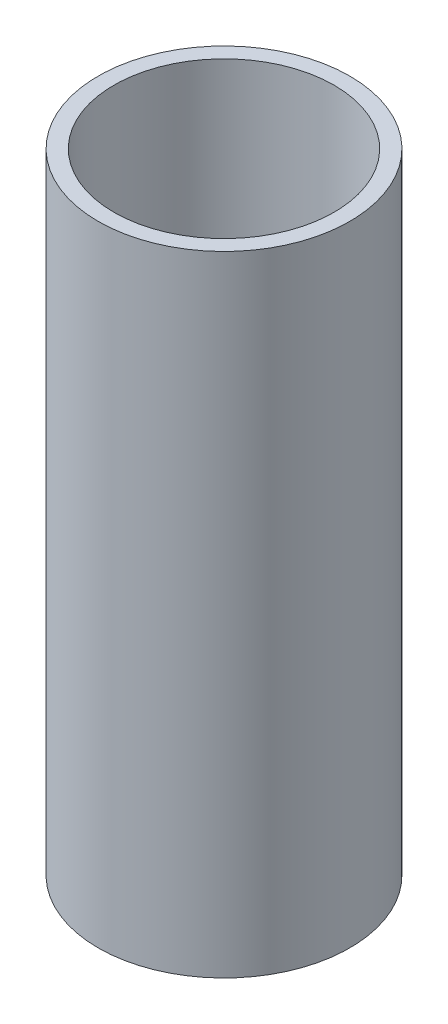
from build123d import *

# Parameters (mm, degrees)
SKETCH1_R           = 16
SKETCH1_R_2         = 14
BOSS_EXTRUDE1_DEPTH = 80


with BuildPart() as part:
    # Sketch1 → Boss-Extrude1 (new body)
    with BuildSketch(Plane(origin=(0, 0, 0), x_dir=(1, 0, 0), z_dir=(0, 1, 0))):
        with Locations(Location((0, 0, 0), (0, 0, 270))):
            Circle(SKETCH1_R)
        with Locations(Location((0, 0, 0), (0, 0, 270))):
            Circle(SKETCH1_R_2, mode=Mode.SUBTRACT)
    extrude(amount=BOSS_EXTRUDE1_DEPTH)


solid = part.part
